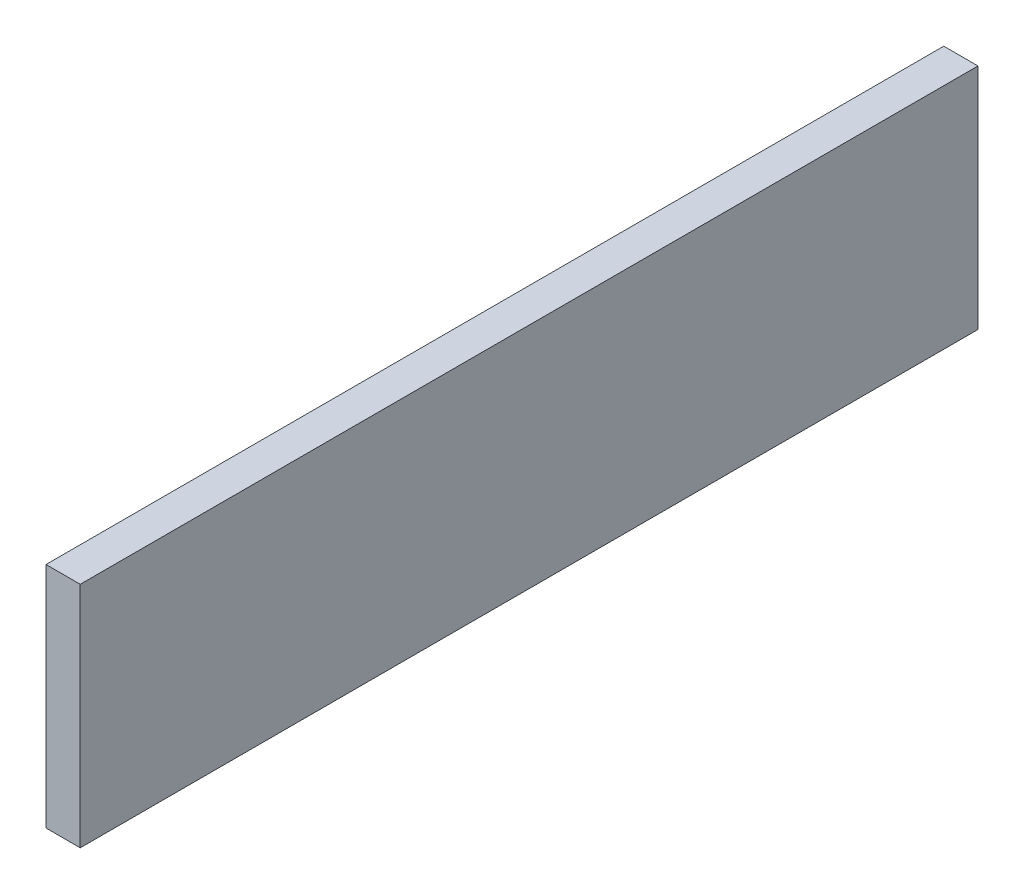
from build123d import *

# Parameters (mm, degrees)
SKETCH1_W           = 472
SKETCH1_H           = 120
BOSS_EXTRUDE1_DEPTH = 18


with BuildPart() as part:
    # Sketch1 → Boss-Extrude1 (new body)
    with BuildSketch(Plane(origin=(0, 0, 0), x_dir=(0, 0, -1), z_dir=(1, 0, 0))):
        with Locations((236, 60)):
            Rectangle(SKETCH1_W, SKETCH1_H)
    extrude(amount=BOSS_EXTRUDE1_DEPTH)


solid = part.part
